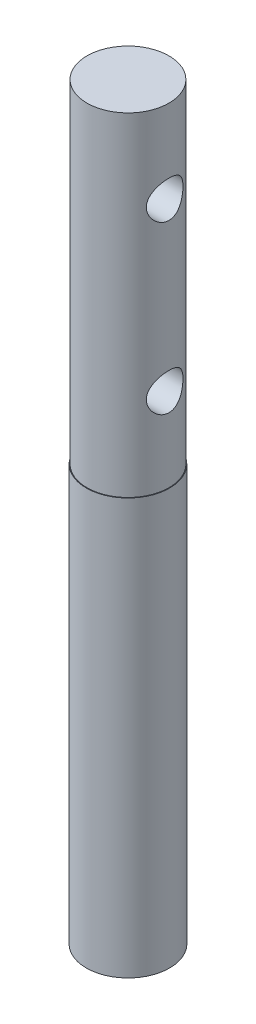
from build123d import *

# Parameters (mm, degrees)
SKETCH1_R               = 25
BOSS_EXTRUDE1_DEPTH     = 249.6
SKETCH2_R               = 24.61
BOSS_EXTRUDE2_DEPTH     = 200
CUT_EXTRUDE1_DEPTH      = 451.987982102
CUT_EXTRUDE1_DEPTH_BACK = 451.987982102
SKETCH3_R               = 11


with BuildPart() as part:
    # Sketch1 → Boss-Extrude1 (new body)
    with BuildSketch(Plane(origin=(0, 0, 0), x_dir=(1, 0, 0), z_dir=(0, 1, 0))):
        with Locations(Location((0, 0, 0), (0, 0, 270))):
            Circle(SKETCH1_R)
    extrude(amount=BOSS_EXTRUDE1_DEPTH)

    # Sketch2 → Boss-Extrude2 (add)
    with BuildSketch(Plane(origin=(0, 249.6, 0), x_dir=(1, 0, 0), z_dir=(0, 1, 0))):
        with Locations(Location((0, 0, 0), (0, 0, 270))):
            Circle(SKETCH2_R)
    extrude(amount=BOSS_EXTRUDE2_DEPTH)

    # Sketch3 → Cut-Extrude1 (cut, two sides: drawn at the far end of the back side and taken through both)
    with BuildSketch(Plane(origin=(0, 0, 0), x_dir=(0, 0, -1), z_dir=(1, 0, 0)).offset(-CUT_EXTRUDE1_DEPTH_BACK)):
        with Locations((0, 299.6)):
            Circle(SKETCH3_R)
        with Locations((0, 399.6)):
            Circle(SKETCH3_R)
    extrude(amount=CUT_EXTRUDE1_DEPTH + CUT_EXTRUDE1_DEPTH_BACK, mode=Mode.SUBTRACT)


solid = part.part
